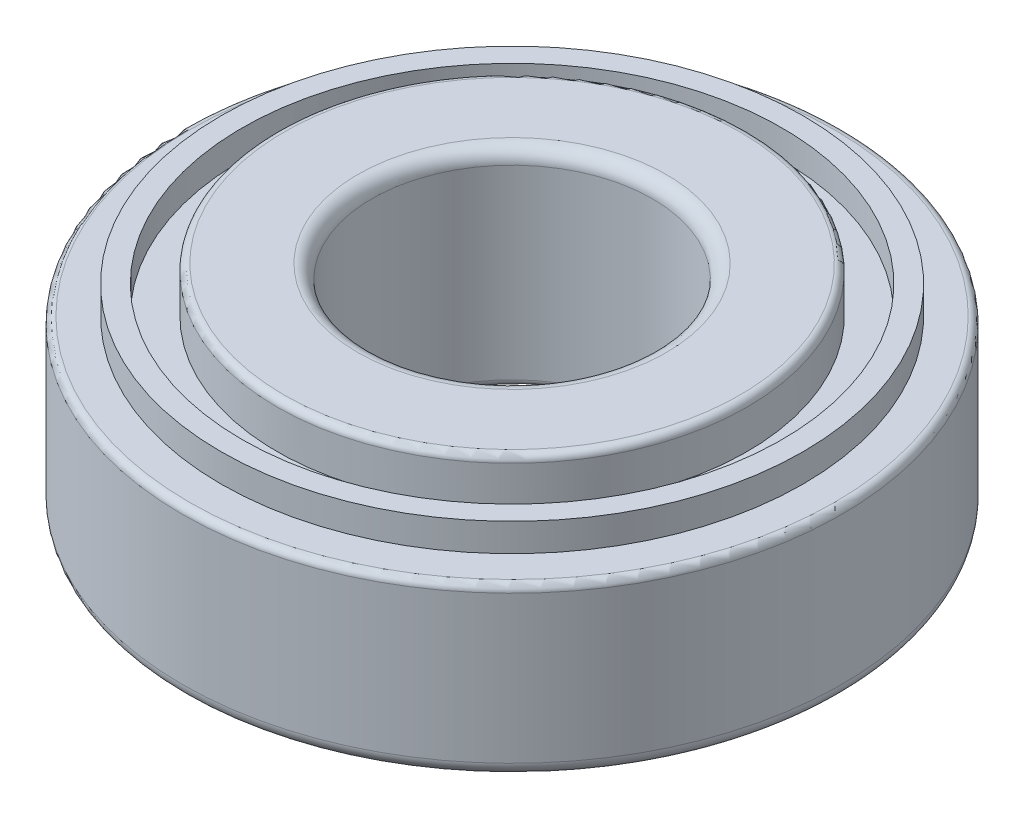
from build123d import *

# Parameters (mm, degrees)
SKETCH1_R           = 23.5
BOSS_EXTRUDE1_DEPTH = 12
SKETCH2_R           = 16.75
BOSS_EXTRUDE2_DEPTH = 3.25
SKETCH3_R           = 10
CUT_EXTRUDE1_DEPTH  = 37.56586523
SKETCH5_R           = 20.75
SKETCH5_R_2         = 19.25
BOSS_EXTRUDE3_DEPTH = 2
FILLET1_R           = 1
FILLET2_R           = 1
FILLET3_R           = 0.5
FILLET4_R           = 0.5
SKETCH6_R           = 18.5
CUT_EXTRUDE2_DEPTH  = 0.5
FILLET5_R           = 0.5


with BuildPart() as part:
    # Sketch1 → Boss-Extrude1 (new body)
    with BuildSketch(Plane(origin=(0, 0, 0), x_dir=(1, 0, 0), z_dir=(0, 1, 0))):
        with Locations(Location((0, 0, 0), (0, 0, 270))):
            Circle(SKETCH1_R)
    extrude(amount=BOSS_EXTRUDE1_DEPTH)

    # Sketch2 → Boss-Extrude2 (add)
    with BuildSketch(Plane(origin=(0, 12, 0), x_dir=(1, 0, 0), z_dir=(0, 1, 0))):
        with Locations(Location((0, 0, 0), (0, 0, 90))):
            Circle(SKETCH2_R)
    extrude(amount=BOSS_EXTRUDE2_DEPTH)

    # Sketch3 → Cut-Extrude1 (cut, through all)
    with BuildSketch(Plane(origin=(0, 15.25, 0), x_dir=(1, 0, 0), z_dir=(0, 1, 0))):
        with Locations(Location((0, 0, 0), (0, 0, 270))):
            Circle(SKETCH3_R)
    extrude(amount=-CUT_EXTRUDE1_DEPTH, mode=Mode.SUBTRACT)

    # Sketch5 → Boss-Extrude3 (add)
    with BuildSketch(Plane(origin=(0, 12, 0), x_dir=(1, 0, 0), z_dir=(0, 1, 0))):
        with Locations(Location((0, 0, 0), (0, 0, 270))):
            Circle(SKETCH5_R)
        with Locations(Location((0, 0, 0), (0, 0, 270))):
            Circle(SKETCH5_R_2, mode=Mode.SUBTRACT)
    extrude(amount=BOSS_EXTRUDE3_DEPTH)

    # Fillet1
    fillet1_edges = [part.edges().sort_by_distance(p)[0] for p in [
        (0, 0, -23.5),
    ]]
    fillet(fillet1_edges, radius=FILLET1_R)

    # Fillet2
    fillet2_edges = [part.edges().sort_by_distance(p)[0] for p in [
        (0, 15.25, -10),
    ]]
    fillet(fillet2_edges, radius=FILLET2_R)

    # Fillet3
    fillet3_edges = [part.edges().sort_by_distance(p)[0] for p in [
        (0, 15.25, 16.75),
    ]]
    fillet(fillet3_edges, radius=FILLET3_R)

    # Fillet4
    fillet4_edges = [part.edges().sort_by_distance(p)[0] for p in [
        (0, 0, -10),
        (0, 12, -23.5),
    ]]
    fillet(fillet4_edges, radius=FILLET4_R)

    # Sketch6 → Cut-Extrude2 (cut)
    with BuildSketch(Plane(origin=(0, 0, 0), x_dir=(-1, 0, 0), z_dir=(0, -1, 0))):
        with Locations(Location((0, 0, 0), (0, 0, 90))):
            Circle(SKETCH6_R)
    extrude(amount=-CUT_EXTRUDE2_DEPTH, mode=Mode.SUBTRACT)

    # Fillet5
    fillet5_edges = [part.edges().sort_by_distance(p)[0] for p in [
        (0, 0.5, -10),
    ]]
    fillet(fillet5_edges, radius=FILLET5_R)


solid = part.part
